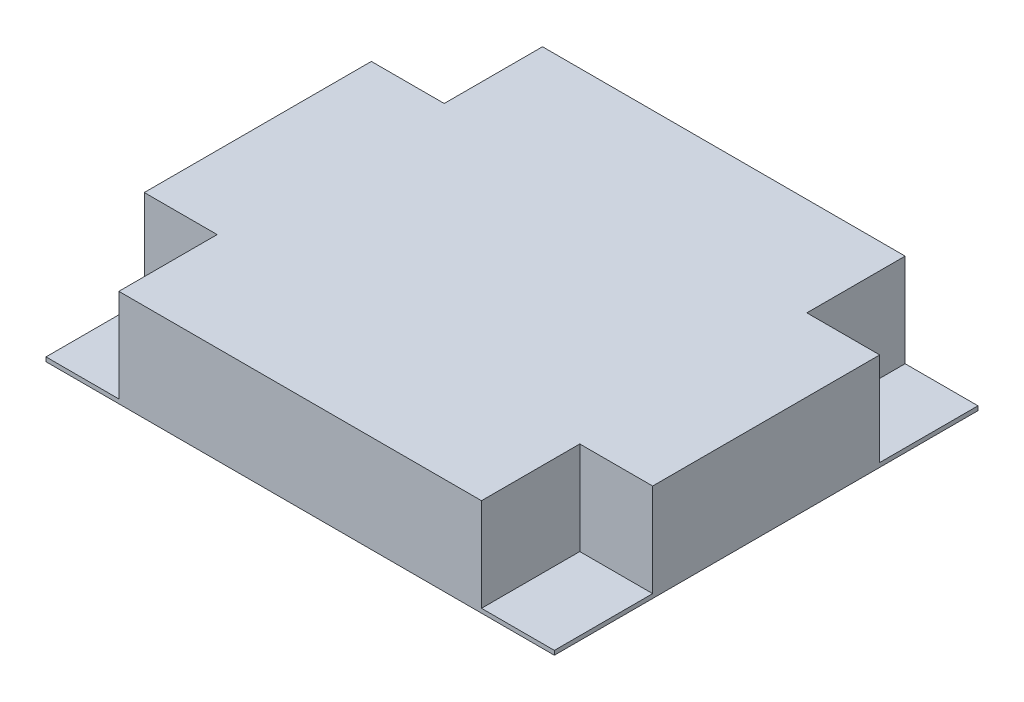
from build123d import *

# Parameters (mm, degrees)
SKETCH1_W           = 600
SKETCH1_H           = 500
BOSS_EXTRUDE1_DEPTH = 115
SKETCH3_W           = 86
SKETCH3_H           = 116
CUT_EXTRUDE1_DEPTH  = 110


with BuildPart() as part:
    # Sketch1 → Boss-Extrude1 (new body)
    with BuildSketch(Plane(origin=(0, 0, 0), x_dir=(1, 0, 0), z_dir=(0, 1, 0))):
        with Locations((300, -250)):
            Rectangle(SKETCH1_W, SKETCH1_H)
    extrude(amount=BOSS_EXTRUDE1_DEPTH)

    # Sketch3 → Cut-Extrude1 (cut)
    with BuildSketch(Plane(origin=(0, 115, 0), x_dir=(1, 0, 0), z_dir=(0, 1, 0))):
        with Locations((43, -442)):
            Rectangle(SKETCH3_W, SKETCH3_H)
        with Locations((43, -58)):
            Rectangle(SKETCH3_W, SKETCH3_H)
        with Locations((557, -58)):
            Rectangle(SKETCH3_W, SKETCH3_H)
        with Locations((557, -442)):
            Rectangle(SKETCH3_W, SKETCH3_H)
    extrude(amount=-CUT_EXTRUDE1_DEPTH, mode=Mode.SUBTRACT)


solid = part.part
